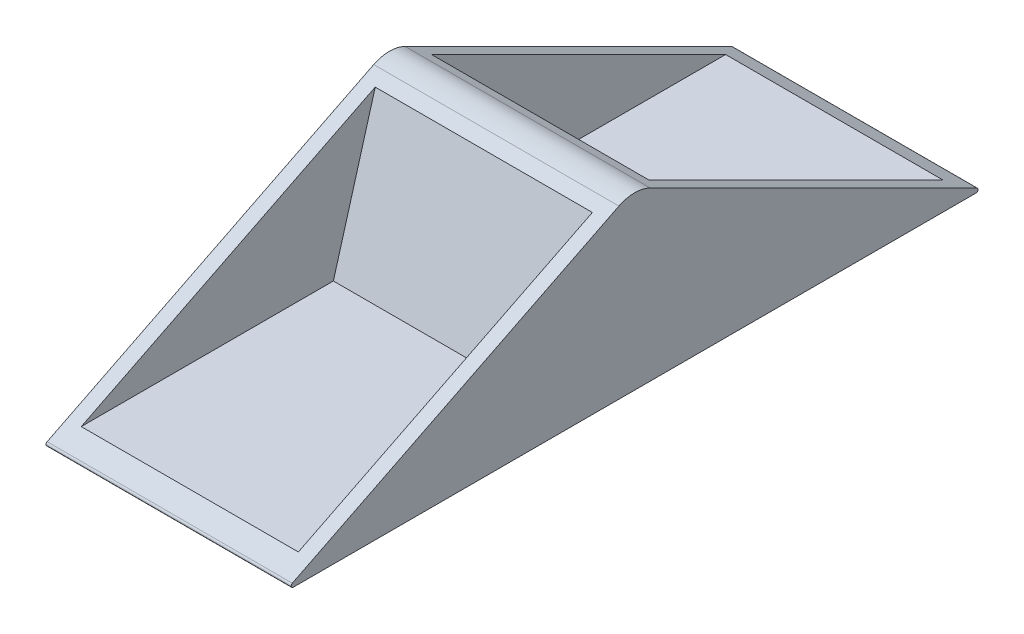
from build123d import *

# Parameters (mm, degrees)
BOSS_EXTRUDE5_DEPTH = 35
SHELL8_T            = -2
BOSS_EXTRUDE6_DEPTH = 31
BOSS_EXTRUDE7_DEPTH = 31
FILLET1_R           = 5
FILLET2_R           = 0.3
FILLET3_R           = 0.3
SKETCH3_W           = 11
SKETCH3_H           = 22
CUT_EXTRUDE2_DEPTH  = 1


with BuildPart() as part:
    # Sketch2 → Boss-Extrude5 (new body)
    with BuildSketch(Plane(origin=(0, 0, 0), x_dir=(0, 0, -1), z_dir=(1, 0, 0))):
        Polygon((0, 0), (50, 0), (0, 25), align=None)
    boss_extrude5 = extrude(amount=BOSS_EXTRUDE5_DEPTH)

    # Mirror1: Boss-Extrude5 across Front Plane
    add(boss_extrude5.mirror(Plane.XY))

    # Shell8
    shell8_openings = [part.faces().sort_by_distance(p)[0] for p in [
        (17.5, 12.5, 25),
        (17.5, 12.5, -25),
    ]]
    offset(amount=SHELL8_T, openings=shell8_openings, kind=Kind.INTERSECTION)

    # 3DSketch9 → Boss-Extrude6 (add)
    with BuildSketch(Plane(origin=(33, 25, 0), x_dir=(0, -0.9850310317593959, -0.1723771054143217), z_dir=(-1, 0, 0))):
        Polygon((0, 0), (2.676141178, -3.617771192), (23.349518196, 0), (21.961909265, 7.929346849), (1.288532246, 4.311575657), align=None)
    extrude(amount=BOSS_EXTRUDE6_DEPTH)

    # 3DSketch10 → Boss-Extrude7 (add)
    with BuildSketch(Plane(origin=(33, 2, -4.024922359), x_dir=(0, 0.9336773848792517, 0.3581152621224651), z_dir=(1, 0, 0))):
        Polygon((0, 0), (-2.139766495, -5.578794866), (19.595590361, -7.515957966), align=None)
        Polygon((2.882772252, 7.515957966), (5.022538747, 13.094752832), (22.478362612, 0), align=None)
    extrude(amount=-BOSS_EXTRUDE7_DEPTH)

    # Fillet1
    fillet1_edges = [part.edges().sort_by_distance(p)[0] for p in [
        (17.5, 25, 0),
    ]]
    fillet(fillet1_edges, radius=FILLET1_R)

    # Fillet2
    fillet2_edges = [part.edges().sort_by_distance(p)[0] for p in [
        (17.5, 0, -50),
    ]]
    fillet(fillet2_edges, radius=FILLET2_R)

    # Fillet3
    fillet3_edges = [part.edges().sort_by_distance(p)[0] for p in [
        (17.5, 0, 50),
    ]]
    fillet(fillet3_edges, radius=FILLET3_R)

    # Sketch3 → Cut-Extrude2 (cut)
    with BuildSketch(Plane.XZ):
        with Locations((12, 0)):
            Rectangle(SKETCH3_W, SKETCH3_H)
        with Locations((23, 0)):
            Rectangle(SKETCH3_W, SKETCH3_H)
    extrude(amount=-CUT_EXTRUDE2_DEPTH, mode=Mode.SUBTRACT)


solid = part.part
